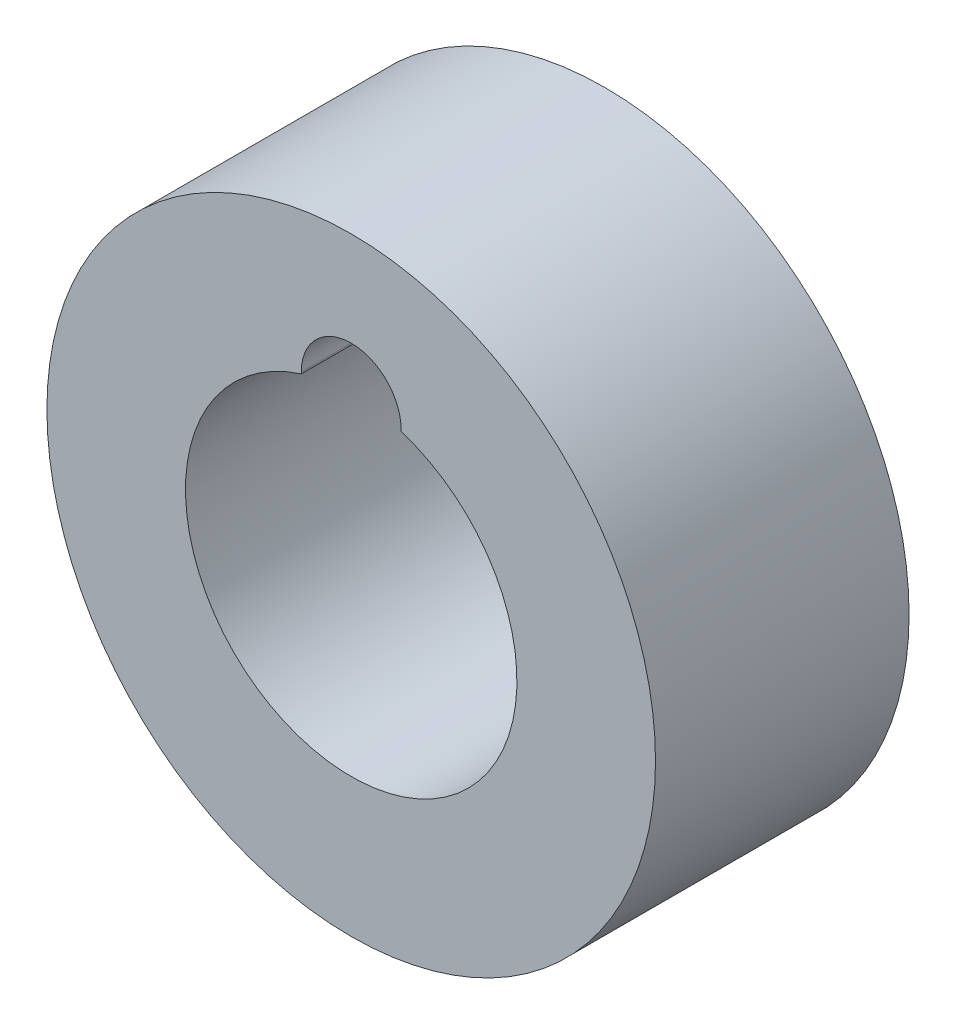
from build123d import *

# Parameters (mm, degrees)
CROQUIS1_R              = 7.62
CROQUIS1_R_2            = 4.15
SALIENTE_EXTRUIR1_DEPTH = 6.35
CORTAR_EXTRUIR1_DEPTH   = 13.508049408


with BuildPart() as part:
    # Croquis1 → Saliente-Extruir1 (new body)
    with BuildSketch(Plane.XY):
        Circle(CROQUIS1_R)
        Circle(CROQUIS1_R_2, mode=Mode.SUBTRACT)
    extrude(amount=SALIENTE_EXTRUIR1_DEPTH)

    # Croquis2 → Cortar-Extruir1 (cut, through all)
    with BuildSketch(Plane.XY.offset(6.35)):
        with BuildLine():
            Line((-1.25, 0), (-1.25, 4))
            ThreePointArc((-1.25, 4), (0, 5.25), (1.25, 4))
            Line((1.25, 4), (1.25, 0))
            ThreePointArc((1.25, 0), (0, -1.25), (-1.25, 0))
        make_face()
    extrude(amount=-CORTAR_EXTRUIR1_DEPTH, mode=Mode.SUBTRACT)


solid = part.part
